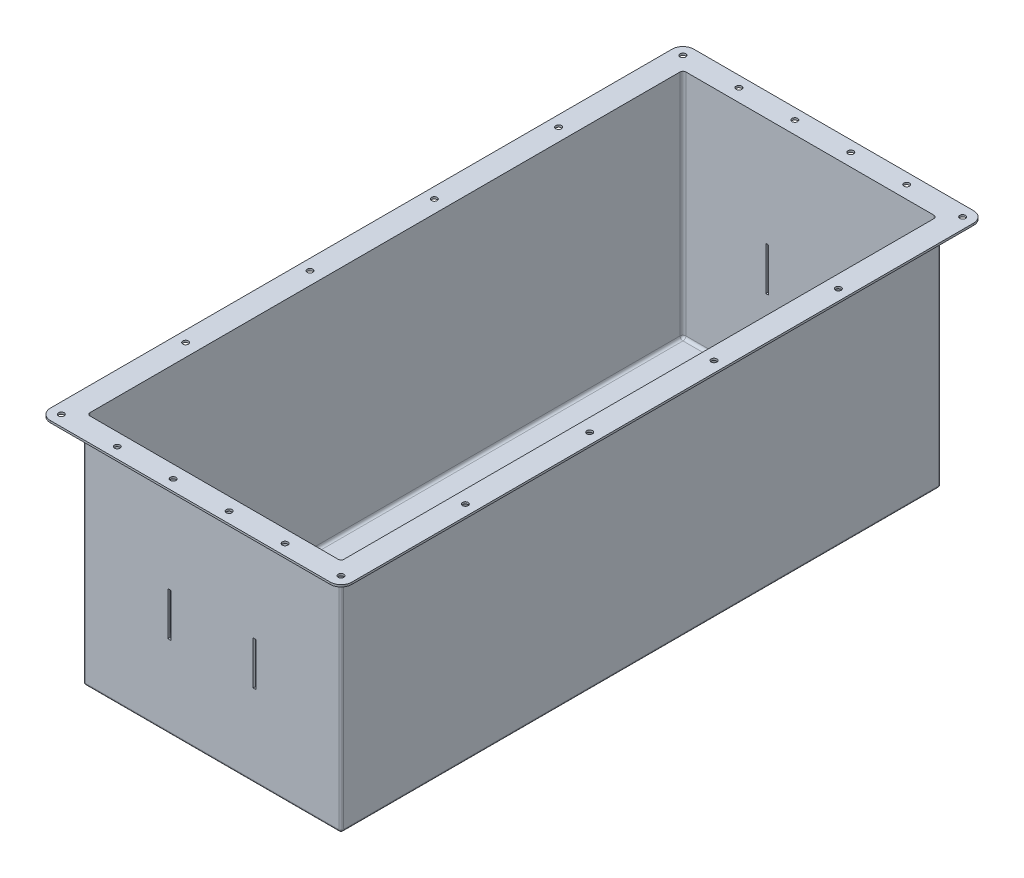
from build123d import *

# Parameters (mm, degrees)
SKETCH1_W              = 226.478396166
SKETCH1_H              = 526.585680888
CONTAINER_BOTTOM_DEPTH = 2.2098
SKETCH2_W              = 226.478396166
SKETCH2_H              = 526.585680888
SKETCH2_W_2            = 222.942716166
SKETCH2_H_2            = 523.050000888
CONTAINER_WALLS_DEPTH  = 203.2
SKETCH64_W             = 264.578396166
SKETCH64_H             = 564.685680888
SKETCH64_W_2           = 226.478396166
SKETCH64_H_2           = 526.585680888
BOSS_EXTRUDE3_DEPTH    = 1.76784
F_10_CLEARANCE_HOLE1_D = 4.9784
FILLET1_R              = 2.54
CUT_EXTRUDE1_REACH     = 375.378
SKETCH42_W             = 2.56159
SKETCH42_H             = 38.1
LPATTERN1_COUNT        = 2
LPATTERN1_PITCH        = 74.903518722
LPATTERN1_COUNT_DIR2   = 2
LPATTERN1_PITCH_DIR2   = 261.525000444
SKETCH43_W             = 2.56159
SKETCH43_H             = 38.1
CUT_EXTRUDE2_DEPTH     = 598.839371507
LPATTERN2_COUNT        = 2
LPATTERN2_PITCH        = 74.903518722
FILLET2_R              = 2
FILLET3_R              = 9.525


with BuildPart() as part:
    # Sketch1 → Container_Bottom (new body)
    with BuildSketch(Plane(origin=(0, 0, 0), x_dir=(1, 0, 0), z_dir=(0, 1, 0))):
        Rectangle(SKETCH1_W, SKETCH1_H)
    extrude(amount=CONTAINER_BOTTOM_DEPTH)

    # Sketch2 → Container_Walls (add)
    with BuildSketch(Plane(origin=(0, 2.2098, 0), x_dir=(1, 0, 0), z_dir=(0, 1, 0))):
        Rectangle(SKETCH2_W, SKETCH2_H)
        Rectangle(SKETCH2_W_2, SKETCH2_H_2, mode=Mode.SUBTRACT)
    extrude(amount=CONTAINER_WALLS_DEPTH)

    # Sketch64 → Boss-Extrude3 (add)
    with BuildSketch(Plane(origin=(0, 205.4098, 0), x_dir=(1, 0, 0), z_dir=(0, 1, 0))):
        Rectangle(SKETCH64_W, SKETCH64_H)
        Rectangle(SKETCH64_W_2, SKETCH64_H_2, mode=Mode.SUBTRACT)
    extrude(amount=-BOSS_EXTRUDE3_DEPTH)

    # #10 Clearance Hole1 (through all)
    with Locations(Plane(origin=(0, 205.4098, 0), x_dir=(1, 0, 0), z_dir=(0, 1, 0))):
        with Locations((-122.764198083, 272.817840444), (-122.764198083, 163.690704266), (-122.764198083, 54.563568089), (-122.764198083, -54.563568089), (-122.764198083, -163.690704266), (-122.764198083, -272.817840444), (-73.65851885, -272.817840444), (-24.552839617, -272.817840444), (-73.65851885, 272.817840444), (-24.552839617, 272.817840444)):
            f_10_clearance_hole1 = Hole(F_10_CLEARANCE_HOLE1_D / 2)

    # Mirror3: #10 Clearance Hole1 across plane
    add(f_10_clearance_hole1.mirror(Plane(origin=(0, 0, 0), x_dir=(0, 0, 1), z_dir=(1, 0, 0))), mode=Mode.SUBTRACT)

    # Fillet1
    fillet1_edges = [part.edges().sort_by_distance(p)[0] for p in [
        (-111.471358083, 2.2098, 0),
        (0, 2.2098, 261.525000444),
        (111.471358083, 2.2098, 0),
        (0, 2.2098, -261.525000444),
        (-111.471358083, 103.8098, 261.525000444),
        (111.471358083, 103.8098, 261.525000444),
        (111.471358083, 103.8098, -261.525000444),
        (-111.471358083, 103.8098, -261.525000444),
    ]]
    fillet(fillet1_edges, radius=FILLET1_R)

    # Sketch42 → Cut-Extrude1 (cut, up to next)
    with BuildSketch(Plane.XZ, mode=Mode.PRIVATE) as cut_extrude1_sk1:
        with Locations((-37.451759361, 130.762500222)):
            Rectangle(SKETCH42_W, SKETCH42_H)
    cut_extrude1_tool1 = extrude(cut_extrude1_sk1.sketch, amount=-CUT_EXTRUDE1_REACH, mode=Mode.PRIVATE) & part.part
    cut_extrude1 = cut_extrude1_tool1.solids().sort_by_distance((-37.451759, 0, 130.7625))[0]
    add(cut_extrude1, mode=Mode.SUBTRACT)

    # LPattern1: Cut-Extrude1 2 × 2
    with Locations(*[(i * LPATTERN1_PITCH, 0, -j * LPATTERN1_PITCH_DIR2) for i in range(LPATTERN1_COUNT) for j in range(LPATTERN1_COUNT_DIR2) if (i, j) != (0, 0)]):
        add(cut_extrude1, mode=Mode.SUBTRACT)

    # Sketch43 → Cut-Extrude2 (cut, through all)
    with BuildSketch(Plane(origin=(0, 0, -263.292840444), x_dir=(-1, 0, 0), z_dir=(0, 0, -1))):
        with Locations((-37.451759361, 91.1098)):
            Rectangle(SKETCH43_W, SKETCH43_H)
    cut_extrude2 = extrude(amount=-CUT_EXTRUDE2_DEPTH, mode=Mode.SUBTRACT)

    # LPattern2: Cut-Extrude2 ×2
    with Locations(*[(-i * LPATTERN2_PITCH, 0, 0) for i in range(1, LPATTERN2_COUNT)]):
        add(cut_extrude2, mode=Mode.SUBTRACT)

    # Fillet2
    fillet2_edges = [part.edges().sort_by_distance(p)[0] for p in [
        (-113.239198083, 101.82098, -263.292840444),
        (113.239198083, 101.82098, -263.292840444),
        (113.239198083, 101.82098, 263.292840444),
        (-113.239198083, 101.82098, 263.292840444),
        (0, 203.64196, -263.292840444),
        (-113.239198083, 203.64196, 0),
        (0, 203.64196, 263.292840444),
        (113.239198083, 203.64196, 0),
        (0, 0, -263.292840444),
        (113.239198083, 0, 0),
        (0, 0, 263.292840444),
        (-113.239198083, 0, 0),
    ]]
    fillet(fillet2_edges, radius=FILLET2_R)

    # Fillet3
    fillet3_edges = [part.edges().sort_by_distance(p)[0] for p in [
        (-132.289198083, 204.52588, 282.342840444),
        (-132.289198083, 204.52588, -282.342840444),
        (132.289198083, 204.52588, -282.342840444),
        (132.289198083, 204.52588, 282.342840444),
    ]]
    fillet(fillet3_edges, radius=FILLET3_R)


solid = part.part
